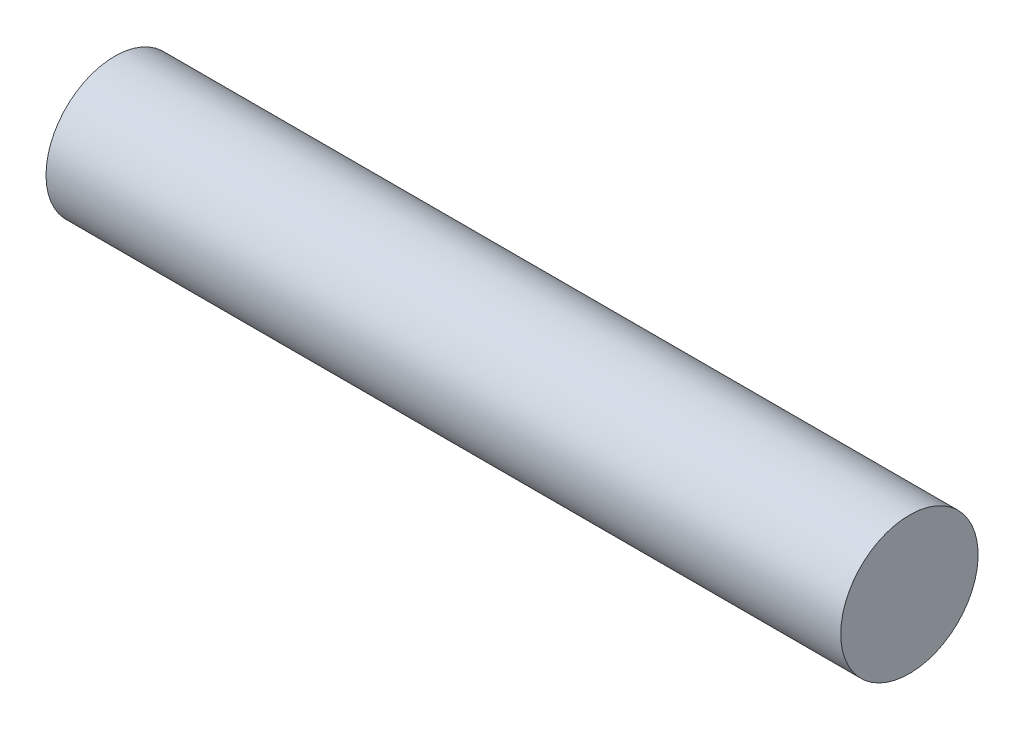
from build123d import *

# Parameters (mm, degrees)
SKETCH_1_W = 81
SKETCH_1_H = 7


with BuildPart() as part:
    # 草图1 → 旋转1 (revolve)
    with BuildSketch(Plane.XY, mode=Mode.PRIVATE) as revolve_1_sk:
        with Locations((40.5, 3.5)):
            Rectangle(SKETCH_1_W, SKETCH_1_H)
    revolve(revolve_1_sk.sketch.rotate(Axis((0, 0, 0), (1, 0, 0)), 90), axis=Axis((0, 0, 0), (1, 0, 0)))


solid = part.part
